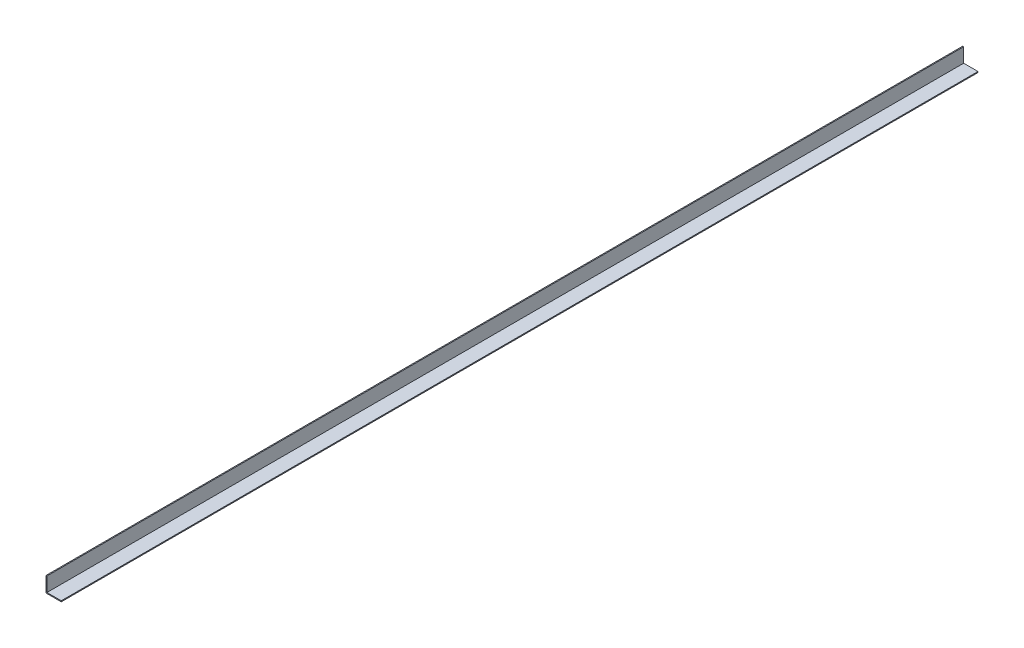
from build123d import *

# Parameters (mm, degrees)
SALIENTE_EXTRUIR1_DEPTH = 6100


with BuildPart() as part:
    # Croquis1 → Saliente-Extruir1 (new body)
    with BuildSketch(Plane.XY):
        Polygon((0, 101.6), (0, 0), (101.6, 0), (101.6, 6.35), (6.35, 6.35), (6.35, 101.6), align=None)
    extrude(amount=-SALIENTE_EXTRUIR1_DEPTH)


solid = part.part
